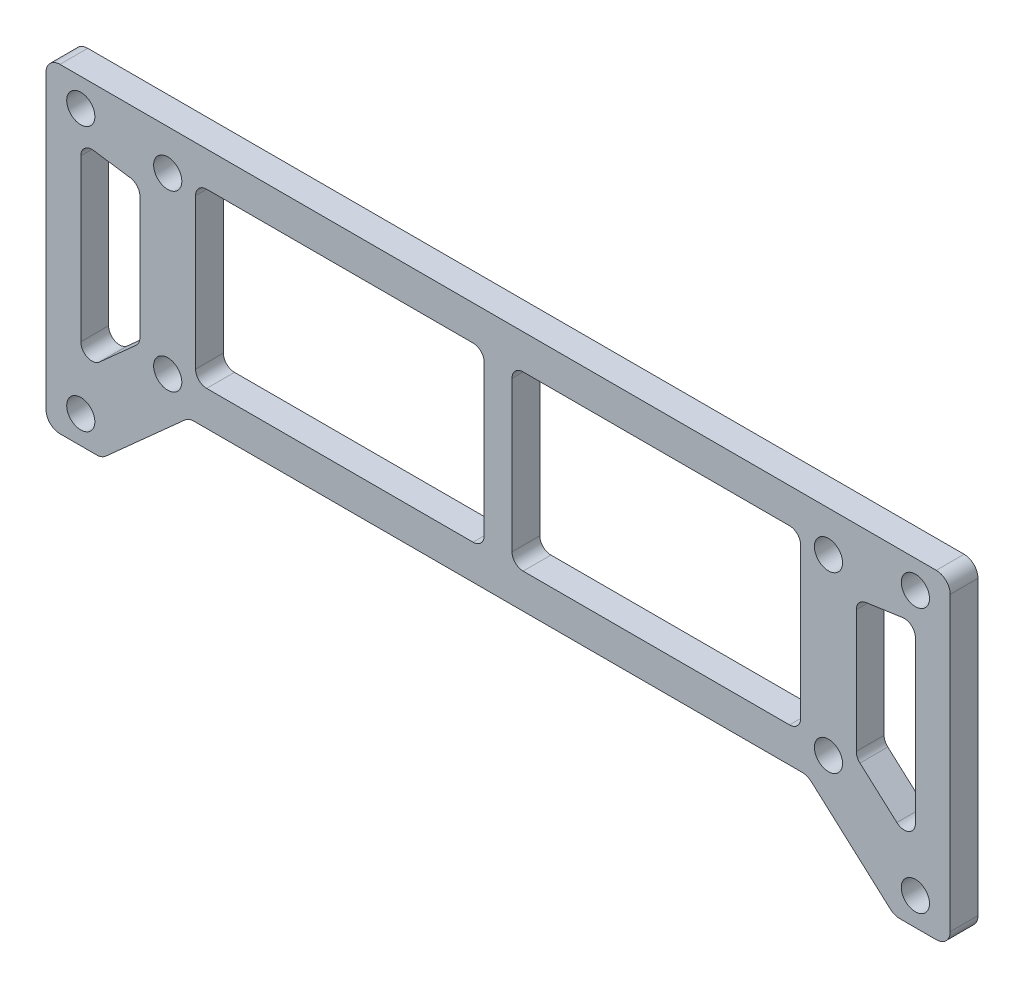
from build123d import *

# Parameters (mm, degrees)
SKETCH_1_W          = 130
SKETCH_1_H          = 46
EXTRUDE_1_DEPTH     = 2
SKETCH_3_R          = 2.025
CUT_EXTRUDE_1_DEPTH = 80
SKETCH_4_R          = 2.025
CUT_EXTRUDE_2_DEPTH = 80
CUT_EXTRUDE_3_DEPTH = 10
SKETCH_6_W          = 41.5
SKETCH_6_H          = 24.8
CUT_EXTRUDE_4_DEPTH = 10
CUT_EXTRUDE_5_DEPTH = 10
FILLET_1_R          = 1.6
FILLET_2_R          = 2


with BuildPart() as part:
    # 草图1 → 凸台-拉伸1 (new, symmetric)
    with BuildSketch(Plane.XY):
        Rectangle(SKETCH_1_W, SKETCH_1_H)
    extrude(amount=EXTRUDE_1_DEPTH, both=True)

    # 草图3 → 切除-拉伸1 (cut, symmetric)
    with BuildSketch(Plane(origin=(0, 0, -2), x_dir=(-1, 0, 0), z_dir=(0, 0, -1))):
        with Locations((-60, 19)):
            Circle(SKETCH_3_R)
        with Locations((-60, -19)):
            Circle(SKETCH_3_R)
        with Locations((60, 19)):
            Circle(SKETCH_3_R)
        with Locations((60, -19)):
            Circle(SKETCH_3_R)
    extrude(amount=CUT_EXTRUDE_1_DEPTH, both=True, mode=Mode.SUBTRACT)

    # 草图4 → 切除-拉伸2 (cut, symmetric)
    with BuildSketch(Plane.XY.offset(2)):
        with Locations(Location((47.5, 17.2, 0), (0, 0, 180))):
            Circle(SKETCH_4_R)
        with Locations(Location((47.5, -7.8, 0), (0, 0, 180))):
            Circle(SKETCH_4_R)
        with Locations(Location((-47.5, -7.8, 0), (0, 0, 180))):
            Circle(SKETCH_4_R)
        with Locations(Location((-47.5, 17.2, 0), (0, 0, 180))):
            Circle(SKETCH_4_R)
    extrude(amount=CUT_EXTRUDE_2_DEPTH, both=True, mode=Mode.SUBTRACT)

    # 草图5 → 切除-拉伸3 (cut)
    with BuildSketch(Plane.XY.offset(2)):
        Polygon((-56.971596888, -23), (-44.471596888, -11.8), (44.471596888, -11.8), (56.971596888, -23), align=None)
    extrude(amount=-CUT_EXTRUDE_3_DEPTH, mode=Mode.SUBTRACT)

    # 草图6 → 切除-拉伸4 (cut)
    with BuildSketch(Plane.XY.offset(2)):
        with Locations((-22.75, 5.6)):
            Rectangle(SKETCH_6_W, SKETCH_6_H)
        with Locations((22.75, 5.6)):
            Rectangle(SKETCH_6_W, SKETCH_6_H)
    extrude(amount=-CUT_EXTRUDE_4_DEPTH, mode=Mode.SUBTRACT)

    # 草图7 → 切除-拉伸5 (cut)
    with BuildSketch(Plane.XY.offset(2)):
        Polygon((-60, 14.95874079), (-51.5, 13.73474079), (-51.5, -6.01324065), (-60, -13.62924065), align=None)
        Polygon((51.5, -6.01324065), (60, -13.62924065), (60, 14.95874079), (51.5, 13.73474079), align=None)
    extrude(amount=-CUT_EXTRUDE_5_DEPTH, mode=Mode.SUBTRACT)

    # 圆角1
    fillet_1_edges = [part.edges().sort_by_distance(p)[0] for p in [
        (-2, 18, 0),
        (-2, -6.8, 0),
        (-43.5, -6.8, 0),
        (-43.5, 18, 0),
        (2, 18, 0),
        (43.5, 18, 0),
        (43.5, -6.8, 0),
        (2, -6.8, 0),
        (-60, -13.62924065, 0),
        (-60, 14.95874079, 0),
        (-51.5, 13.73474079, 0),
        (-51.5, -6.01324065, 0),
        (51.5, -6.01324065, 0),
        (51.5, 13.73474079, 0),
        (60, 14.95874079, 0),
        (60, -13.62924065, 0),
    ]]
    fillet(fillet_1_edges, radius=FILLET_1_R)

    # 圆角2
    fillet_2_edges = [part.edges().sort_by_distance(p)[0] for p in [
        (56.971596888, -23, 0),
        (-56.971596888, -23, 0),
        (-44.471596888, -11.8, 0),
        (44.471596888, -11.8, 0),
        (65, -23, 0),
        (-65, -23, 0),
        (-65, 23, 0),
        (65, 23, 0),
    ]]
    fillet(fillet_2_edges, radius=FILLET_2_R)


solid = part.part
